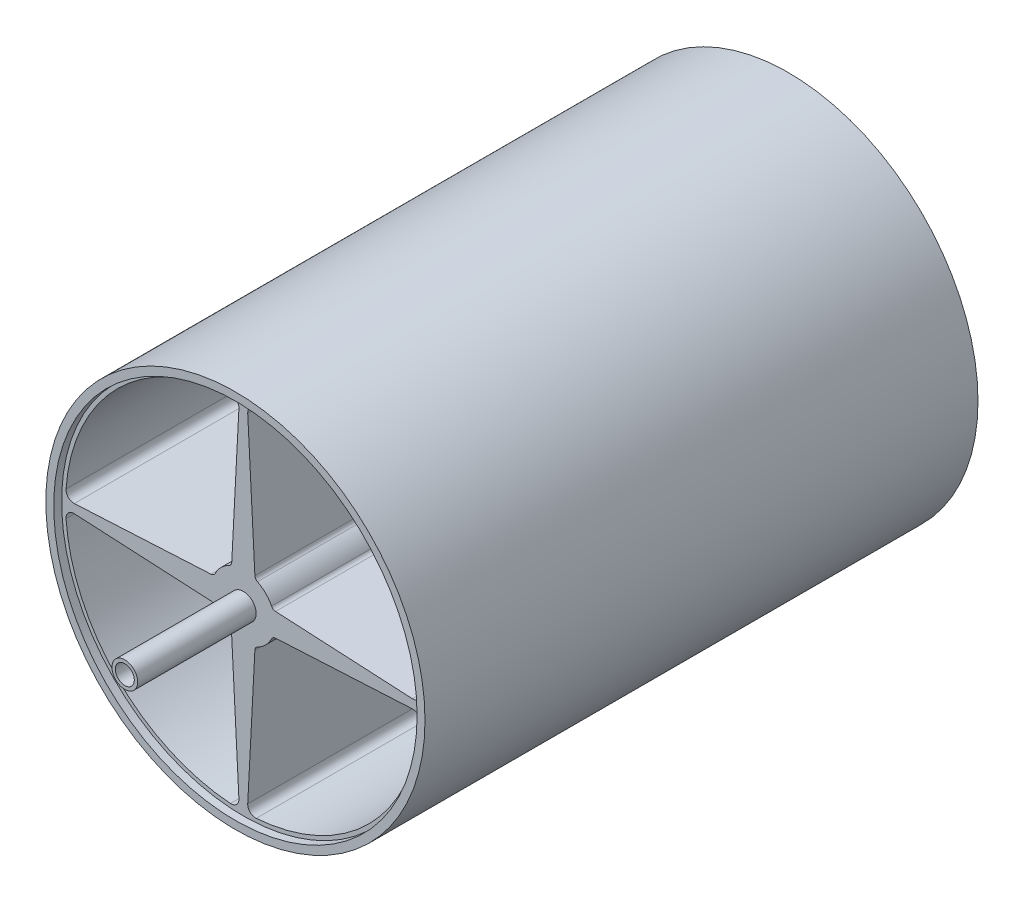
from build123d import *

# Parameters (mm, degrees)
SKETCH1_R           = 240
BOSS_EXTRUDE1_DEPTH = 700
SKETCH2_R           = 230
CUT_EXTRUDE1_DEPTH  = 10
CUT_EXTRUDE2_START  = -10
SKETCH3_R           = 230
CUT_EXTRUDE2_DEPTH  = 10
CUT_EXTRUDE3_REACH  = 770.96
SKETCH5_R           = 16.25
BOSS_EXTRUDE2_DEPTH = 150
BOSS_EXTRUDE3_START = 150
SKETCH6_R           = 16.25
BOSS_EXTRUDE3_DEPTH = 150
SKETCH7_R           = 12
CUT_EXTRUDE4_DEPTH  = 50
CUT_EXTRUDE5_START  = -50
SKETCH8_R           = 12
CUT_EXTRUDE5_DEPTH  = 50
CUT_EXTRUDE8_START  = -45
CUT_EXTRUDE8_DEPTH  = 45


with BuildPart() as part:
    # Sketch1 → Boss-Extrude1 (new body)
    with BuildSketch(Plane.XY):
        Circle(SKETCH1_R)
    extrude(amount=BOSS_EXTRUDE1_DEPTH)

    # Sketch2 → Cut-Extrude1 (cut)
    with BuildSketch(Plane.XY.offset(700)):
        Circle(SKETCH2_R)
    extrude(amount=-CUT_EXTRUDE1_DEPTH, mode=Mode.SUBTRACT)

    # Sketch3 → Cut-Extrude2 (cut)
    with BuildSketch(Plane(origin=(0, 0, 0), x_dir=(-1, 0, 0), z_dir=(0, 0, -1)).offset(CUT_EXTRUDE2_START)):
        with Locations(Location((0, 0, 0), (0, 0, 180))):
            Circle(SKETCH3_R)
    extrude(amount=CUT_EXTRUDE2_DEPTH, mode=Mode.SUBTRACT)

    # Sketch4 → Cut-Extrude3 (cut, up to next)
    with BuildSketch(Plane.XY.offset(690), mode=Mode.PRIVATE) as cut_extrude3_sk1:
        with BuildLine():
            Line((-5.578158138, 213.912523134), (-14.650908758, 40.79412842))
            ThreePointArc((-14.650908758, 40.79412842), (-15.620272478, 37.825559391), (-17.95016171, 35.746212311))
            ThreePointArc((-17.95016171, 35.746212311), (-28.284271247, 28.284271247), (-35.746212311, 17.95016171))
            ThreePointArc((-35.746212311, 17.95016171), (-37.825559391, 15.620272478), (-40.79412842, 14.650908758))
            Line((-40.79412842, 14.650908758), (-213.912523134, 5.578158138))
            ThreePointArc((-213.912523134, 5.578158138), (-221.577643537, 8.564792629), (-224.409644682, 16.288381554))
            ThreePointArc((-224.409644682, 16.288381554), (-159.099025767, 159.099025767), (-16.288381554, 224.409644682))
            ThreePointArc((-16.288381554, 224.409644682), (-8.564792629, 221.577643537), (-5.578158138, 213.912523134))
        make_face()
    cut_extrude3_tool1 = extrude(cut_extrude3_sk1.sketch, amount=-CUT_EXTRUDE3_REACH, mode=Mode.PRIVATE) & part.part
    # Sketch4 → Cut-Extrude3 (cut, up to next)
    with BuildSketch(Plane.XY.offset(690), mode=Mode.PRIVATE) as cut_extrude3_sk2:
        with BuildLine():
            Line((5.578158138, 213.912523134), (14.650908758, 40.79412842))
            ThreePointArc((14.650908758, 40.79412842), (15.620272478, 37.825559391), (17.95016171, 35.746212311))
            ThreePointArc((17.95016171, 35.746212311), (28.284271247, 28.284271247), (35.746212311, 17.95016171))
            ThreePointArc((35.746212311, 17.95016171), (37.825559391, 15.620272478), (40.79412842, 14.650908758))
            Line((40.79412842, 14.650908758), (213.912523134, 5.578158138))
            ThreePointArc((213.912523134, 5.578158138), (221.577643537, 8.564792629), (224.409644682, 16.288381554))
            ThreePointArc((224.409644682, 16.288381554), (159.099025767, 159.099025767), (16.288381554, 224.409644682))
            ThreePointArc((16.288381554, 224.409644682), (8.564792629, 221.577643537), (5.578158138, 213.912523134))
        make_face()
    cut_extrude3_tool2 = extrude(cut_extrude3_sk2.sketch, amount=-CUT_EXTRUDE3_REACH, mode=Mode.PRIVATE) & part.part
    # Sketch4 → Cut-Extrude3 (cut, up to next)
    with BuildSketch(Plane.XY.offset(690), mode=Mode.PRIVATE) as cut_extrude3_sk3:
        with BuildLine():
            Line((-213.912523134, -5.578158138), (-40.79412842, -14.650908758))
            ThreePointArc((-40.79412842, -14.650908758), (-37.825559391, -15.620272478), (-35.746212311, -17.95016171))
            ThreePointArc((-35.746212311, -17.95016171), (-28.284271247, -28.284271247), (-17.95016171, -35.746212311))
            ThreePointArc((-17.95016171, -35.746212311), (-15.620272478, -37.825559391), (-14.650908758, -40.79412842))
            Line((-14.650908758, -40.79412842), (-5.578158138, -213.912523134))
            ThreePointArc((-5.578158138, -213.912523134), (-8.564792629, -221.577643537), (-16.288381554, -224.409644682))
            ThreePointArc((-16.288381554, -224.409644682), (-159.099025767, -159.099025767), (-224.409644682, -16.288381554))
            ThreePointArc((-224.409644682, -16.288381554), (-221.577643537, -8.564792629), (-213.912523134, -5.578158138))
        make_face()
    cut_extrude3_tool3 = extrude(cut_extrude3_sk3.sketch, amount=-CUT_EXTRUDE3_REACH, mode=Mode.PRIVATE) & part.part
    # Sketch4 → Cut-Extrude3 (cut, up to next)
    with BuildSketch(Plane.XY.offset(690), mode=Mode.PRIVATE) as cut_extrude3_sk4:
        with BuildLine():
            Line((213.912523134, -5.578158138), (40.79412842, -14.650908758))
            ThreePointArc((40.79412842, -14.650908758), (37.825559391, -15.620272478), (35.746212311, -17.95016171))
            ThreePointArc((35.746212311, -17.95016171), (28.284271247, -28.284271247), (17.95016171, -35.746212311))
            ThreePointArc((17.95016171, -35.746212311), (15.620272478, -37.825559391), (14.650908758, -40.79412842))
            Line((14.650908758, -40.79412842), (5.578158138, -213.912523134))
            ThreePointArc((5.578158138, -213.912523134), (8.564792629, -221.577643537), (16.288381554, -224.409644682))
            ThreePointArc((16.288381554, -224.409644682), (159.099025767, -159.099025767), (224.409644682, -16.288381554))
            ThreePointArc((224.409644682, -16.288381554), (221.577643537, -8.564792629), (213.912523134, -5.578158138))
        make_face()
    cut_extrude3_tool4 = extrude(cut_extrude3_sk4.sketch, amount=-CUT_EXTRUDE3_REACH, mode=Mode.PRIVATE) & part.part
    add(cut_extrude3_tool1.solids().sort_by_distance((-101.943067, 101.943067, 690))[0], mode=Mode.SUBTRACT)
    add(cut_extrude3_tool2.solids().sort_by_distance((101.943067, 101.943067, 690))[0], mode=Mode.SUBTRACT)
    add(cut_extrude3_tool3.solids().sort_by_distance((-101.943067, -101.943067, 690))[0], mode=Mode.SUBTRACT)
    add(cut_extrude3_tool4.solids().sort_by_distance((101.943067, -101.943067, 690))[0], mode=Mode.SUBTRACT)

    # Sketch5 → Boss-Extrude2 (add)
    with BuildSketch(Plane.XY.offset(690)):
        Circle(SKETCH5_R)
    extrude(amount=BOSS_EXTRUDE2_DEPTH)

    # Sketch6 → Boss-Extrude3 (add)
    with BuildSketch(Plane(origin=(0, 0, 10), x_dir=(-1, 0, 0), z_dir=(0, 0, -1)).offset(BOSS_EXTRUDE3_START)):
        with Locations(Location((0, 0, 0), (0, 0, 180))):
            Circle(SKETCH6_R)
    extrude(amount=-BOSS_EXTRUDE3_DEPTH)

    # Sketch7 → Cut-Extrude4 (cut)
    with BuildSketch(Plane.XY.offset(840)):
        Circle(SKETCH7_R)
    extrude(amount=-CUT_EXTRUDE4_DEPTH, mode=Mode.SUBTRACT)

    # Sketch8 → Cut-Extrude5 (cut)
    with BuildSketch(Plane(origin=(0, 0, -140), x_dir=(-1, 0, 0), z_dir=(0, 0, -1)).offset(CUT_EXTRUDE5_START)):
        with Locations(Location((0, 0, 0), (0, 0, 180))):
            Circle(SKETCH8_R)
    extrude(amount=CUT_EXTRUDE5_DEPTH, mode=Mode.SUBTRACT)

    # Sketch10 → Cut-Extrude8 (cut)
    with BuildSketch(Plane(origin=(0, 0, -140), x_dir=(-1, 0, 0), z_dir=(0, 0, -1)).offset(CUT_EXTRUDE8_START)):
        with BuildLine():
            Line((-4, 11.313708499), (-4, 15.003708499))
            Line((-4, 15.003708499), (4, 15.003708499))
            Line((4, 15.003708499), (4, 11.313708499))
            ThreePointArc((4, 11.313708499), (0, 12), (-4, 11.313708499))
        make_face()
    extrude(amount=CUT_EXTRUDE8_DEPTH, mode=Mode.SUBTRACT)


solid = part.part
